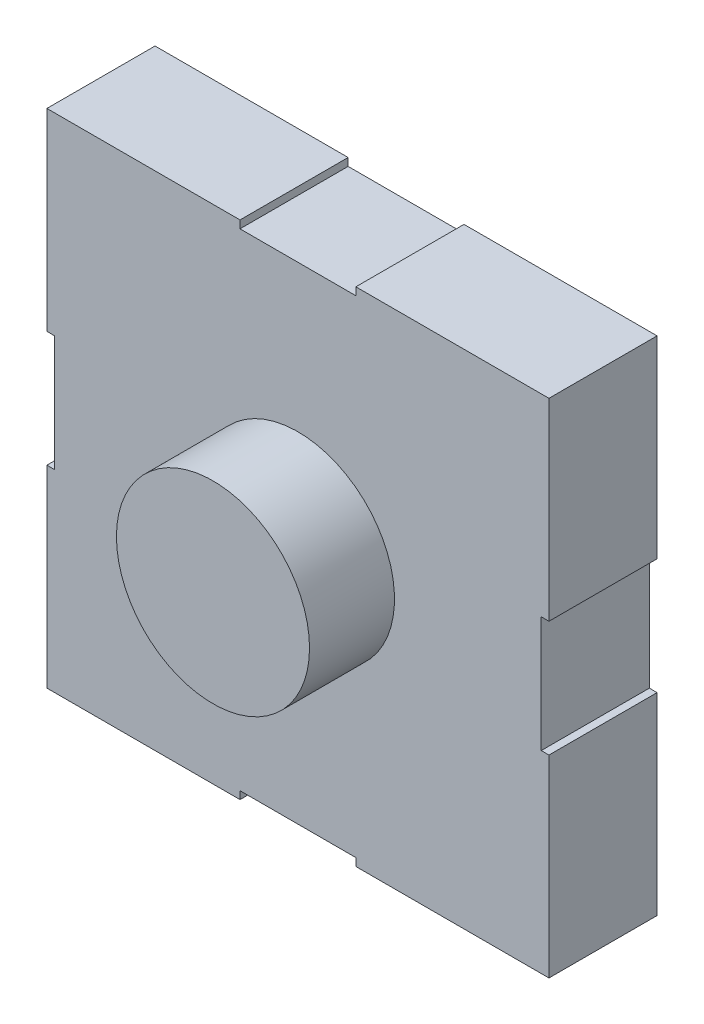
from build123d import *

# Parameters (mm, degrees)
BOSS_EXTRU_1_DEPTH = 1.4
ESQUISSE2_R        = 1.25
BOSS_EXTRU_2_DEPTH = 1.1


with BuildPart() as part:
    # Esquisse1 → Boss.-Extru.1 (new body)
    with BuildSketch(Plane.XY):
        Polygon((-3.25, 0.75), (-3.25, 3.25), (-0.75, 3.25), (-0.75, 3.15), (0.75, 3.15), (0.75, 3.25), (3.25, 3.25), (3.25, 0.75), (3.15, 0.75), (3.15, -0.75), (3.25, -0.75), (3.25, -3.25), (0.75, -3.25), (0.75, -3.15), (-0.75, -3.15), (-0.75, -3.25), (-3.25, -3.25), (-3.25, -0.75), (-3.15, -0.75), (-3.15, 0.75), align=None)
    extrude(amount=BOSS_EXTRU_1_DEPTH)

    # Esquisse2 → Boss.-Extru.2 (add)
    with BuildSketch(Plane.XY.offset(1.4)):
        with Locations(Location((0, 0, 0), (0, 0, 180))):
            Circle(ESQUISSE2_R)
    extrude(amount=BOSS_EXTRU_2_DEPTH)


solid = part.part
